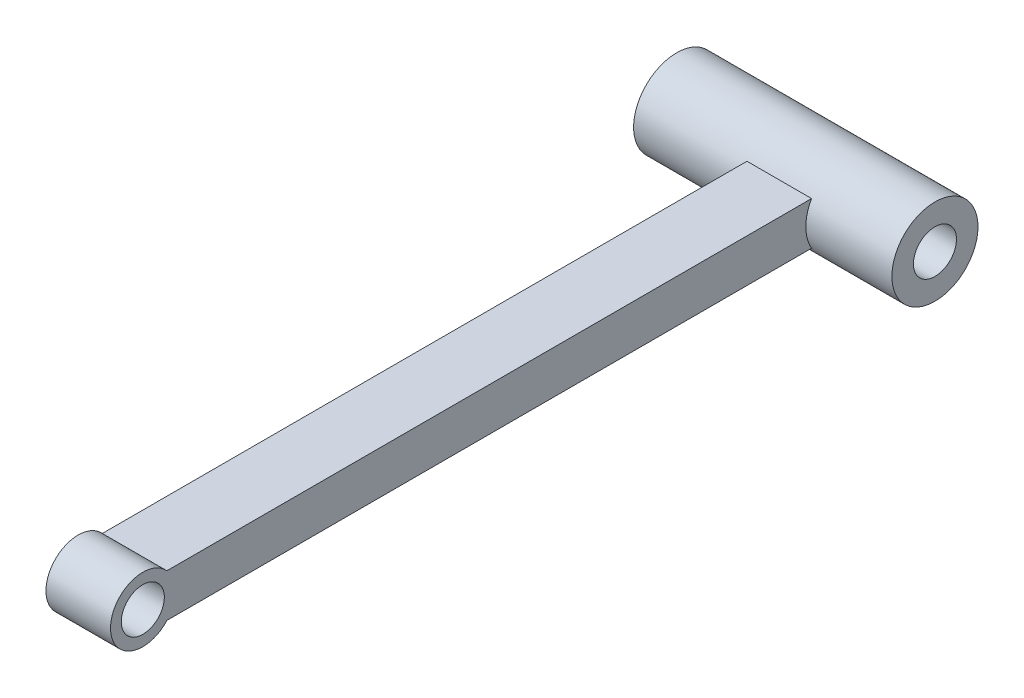
from build123d import *

# Parameters (mm, degrees)
SKETCH1_R           = 10
SKETCH1_R_2         = 5
BOSS_EXTRUDE1_DEPTH = 60
SKETCH2_R           = 5
BOSS_EXTRUDE2_DEPTH = 15


with BuildPart() as part:
    # Sketch1 → Boss-Extrude1 (new body)
    with BuildSketch(Plane(origin=(0, 0, 0), x_dir=(0, 0, -1), z_dir=(1, 0, 0))):
        Circle(SKETCH1_R)
        Circle(SKETCH1_R_2, mode=Mode.SUBTRACT)
    extrude(amount=BOSS_EXTRUDE1_DEPTH)


with BuildPart() as body_2:
    # Sketch2 → Boss-Extrude2 (new body)
    with BuildSketch(Plane.ZY):
        with BuildLine():
            ThreePointArc((158.409830056, -5), (171.5, 0), (158.409830056, 5))
            Line((158.409830056, 5), (8.660254038, 5))
            ThreePointArc((8.660254038, 5), (9.659258263, 2.588190451), (10, 0))
            ThreePointArc((10, 0), (9.659258263, -2.588190451), (8.660254038, -5))
            Line((8.660254038, -5), (158.409830056, -5))
        make_face()
        with Locations((164, 0)):
            Circle(SKETCH2_R, mode=Mode.SUBTRACT)
    extrude(amount=-BOSS_EXTRUDE2_DEPTH)


with BuildPart() as body_2_1:
    # Body-Move/Copy1: moved
    add(body_2.part.moved(Location((25, 0, 0))))


solid = Compound([part.part, body_2_1.part])
